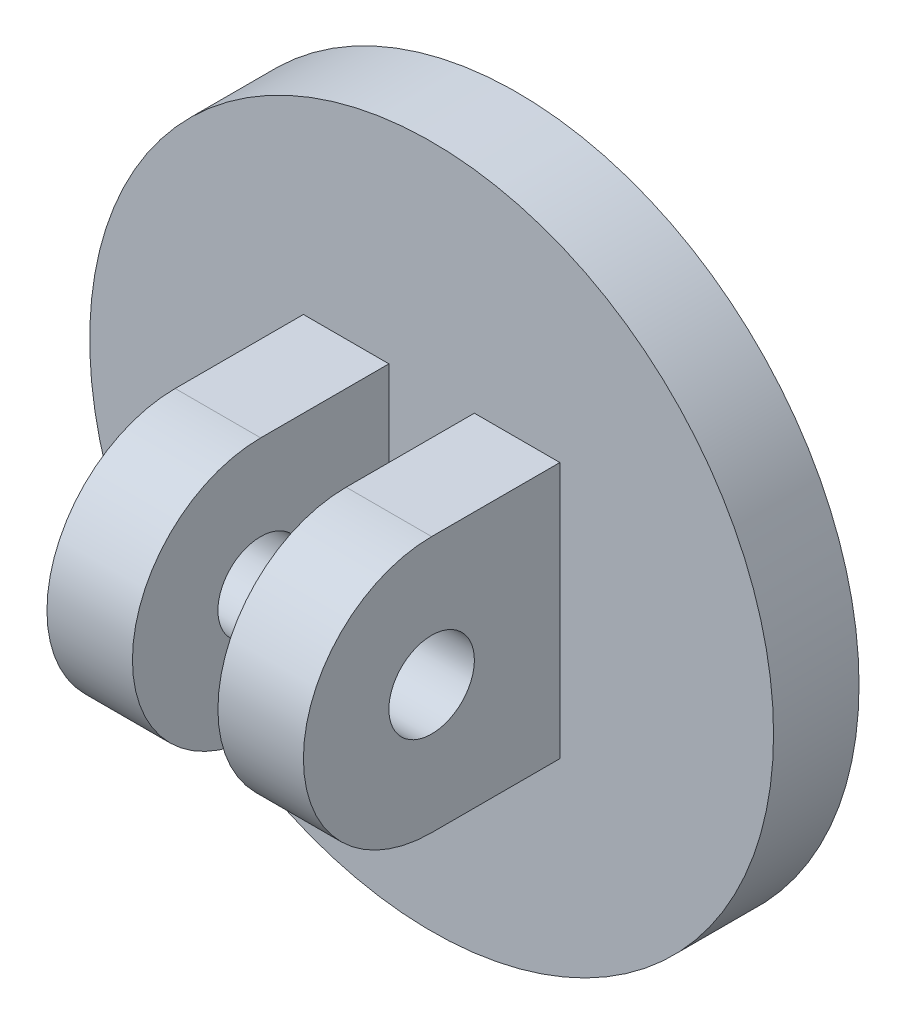
from build123d import *

# Parameters (mm, degrees)
CROQUIS1_R              = 20
SALIENTE_EXTRUIR1_DEPTH = 5
CROQUIS2_R              = 2.5
CORTAR_EXTRUIR1_DEPTH   = 5
CROQUIS3_W              = 5
CROQUIS3_H              = 15
SALIENTE_EXTRUIR3_DEPTH = 15
CROQUIS4_R              = 2.5
CORTAR_EXTRUIR2_DEPTH   = 5


with BuildPart() as part:
    # Croquis1 → Saliente-Extruir1 (new body)
    with BuildSketch(Plane.XY):
        Circle(CROQUIS1_R)
    extrude(amount=SALIENTE_EXTRUIR1_DEPTH)

    # Croquis2 → Cortar-Extruir1 (cut)
    with BuildSketch(Plane.XY.offset(5)):
        Circle(CROQUIS2_R)
    extrude(amount=-CORTAR_EXTRUIR1_DEPTH, mode=Mode.SUBTRACT)

    # Croquis3 → Saliente-Extruir3 (add)
    with BuildSketch(Plane.XY.offset(5)):
        with Locations((5, 0)):
            Rectangle(CROQUIS3_W, CROQUIS3_H)
    extrude(amount=SALIENTE_EXTRUIR3_DEPTH)

    # Croquis4 → Cortar-Extruir2 (cut)
    with BuildSketch(Plane(origin=(7.5, 0, 0), x_dir=(0, 0, -1), z_dir=(1, 0, 0))):
        with BuildLine():
            ThreePointArc((-12.5, -7.5), (-17.803300859, -5.303300859), (-20, 0))
            Line((-20, 0), (-20, -7.5))
            Line((-20, -7.5), (-12.5, -7.5))
        make_face()
        with BuildLine():
            ThreePointArc((-20, 0), (-17.803300859, 5.303300859), (-12.5, 7.5))
            Line((-12.5, 7.5), (-20, 7.5))
            Line((-20, 7.5), (-20, 0))
        make_face()
        with Locations(Location((-12.5, 0, 0), (0, 0, 90))):
            Circle(CROQUIS4_R)
    extrude(amount=-CORTAR_EXTRUIR2_DEPTH, mode=Mode.SUBTRACT)

    # Simetría1: part across plane


with BuildPart() as part_1:
    add(part.part)
    add(part.part.mirror(Plane(origin=(0, 0, 0), x_dir=(0, 0, 1), z_dir=(1, 0, 0))))


solid = part_1.part
